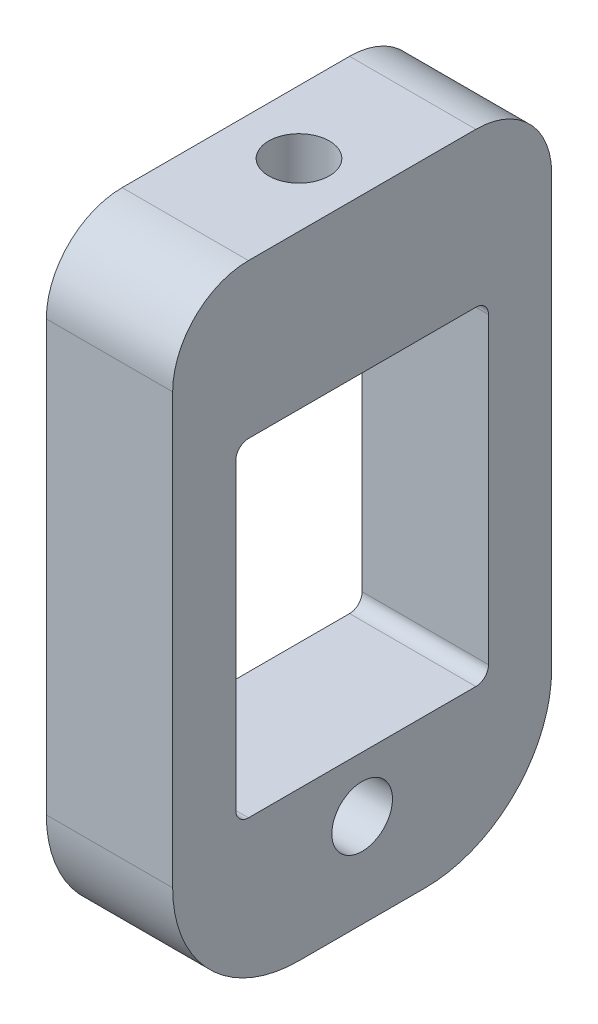
from build123d import *

# Parameters (mm, degrees)
SKETCH16_W                 = 5
SKETCH16_H                 = 15
MAIN_EXTRUDE_LOCKING_DEPTH = 25
SKETCH18_R                 = 1.2
CUT_EXTRUDE1_DEPTH         = 5
SKETCH8_W                  = 10
SKETCH8_H                  = 13
CUT_EXTRUDE2_DEPTH         = 5
SKETCH9_R                  = 1.2
CUT_EXTRUDE3_DEPTH         = 6.1
FILLET1_R                  = 5
FILLET2_R                  = 3
FILLET3_R                  = 0.5


with BuildPart() as part:
    # Sketch16 → Main Extrude_Locking (new body)
    with BuildSketch(Plane(origin=(0, 0, 0), x_dir=(1, 0, 0), z_dir=(0, 1, 0))):
        Rectangle(SKETCH16_W, SKETCH16_H)
    extrude(amount=MAIN_EXTRUDE_LOCKING_DEPTH)

    # Sketch18 → Cut-Extrude1 (cut)
    with BuildSketch(Plane.ZY.offset(2.5)):
        with Locations((0, 3.7)):
            Circle(SKETCH18_R)
    extrude(amount=-CUT_EXTRUDE1_DEPTH, mode=Mode.SUBTRACT)

    # Sketch8 → Cut-Extrude2 (cut)
    with BuildSketch(Plane.ZY.offset(2.5)):
        with Locations((0, 12.4)):
            Rectangle(SKETCH8_W, SKETCH8_H)
    extrude(amount=-CUT_EXTRUDE2_DEPTH, mode=Mode.SUBTRACT)

    # Sketch9 → Cut-Extrude3 (cut)
    with BuildSketch(Plane(origin=(0, 25, 0), x_dir=(1, 0, 0), z_dir=(0, 1, 0))):
        with Locations(Location((0, 0, 0), (0, 0, 270))):
            Circle(SKETCH9_R)
    extrude(amount=-CUT_EXTRUDE3_DEPTH, mode=Mode.SUBTRACT)

    # Fillet1
    fillet1_edges = [part.edges().sort_by_distance(p)[0] for p in [
        (0, 0, 7.5),
        (0, 0, -7.5),
    ]]
    fillet(fillet1_edges, radius=FILLET1_R)

    # Fillet2
    fillet2_edges = [part.edges().sort_by_distance(p)[0] for p in [
        (0, 25, 7.5),
        (0, 25, -7.5),
    ]]
    fillet(fillet2_edges, radius=FILLET2_R)

    # Fillet3
    fillet3_edges = [part.edges().sort_by_distance(p)[0] for p in [
        (0, 5.9, -5),
        (0, 18.9, -5),
        (0, 18.9, 5),
        (0, 5.9, 5),
    ]]
    fillet(fillet3_edges, radius=FILLET3_R)


solid = part.part
